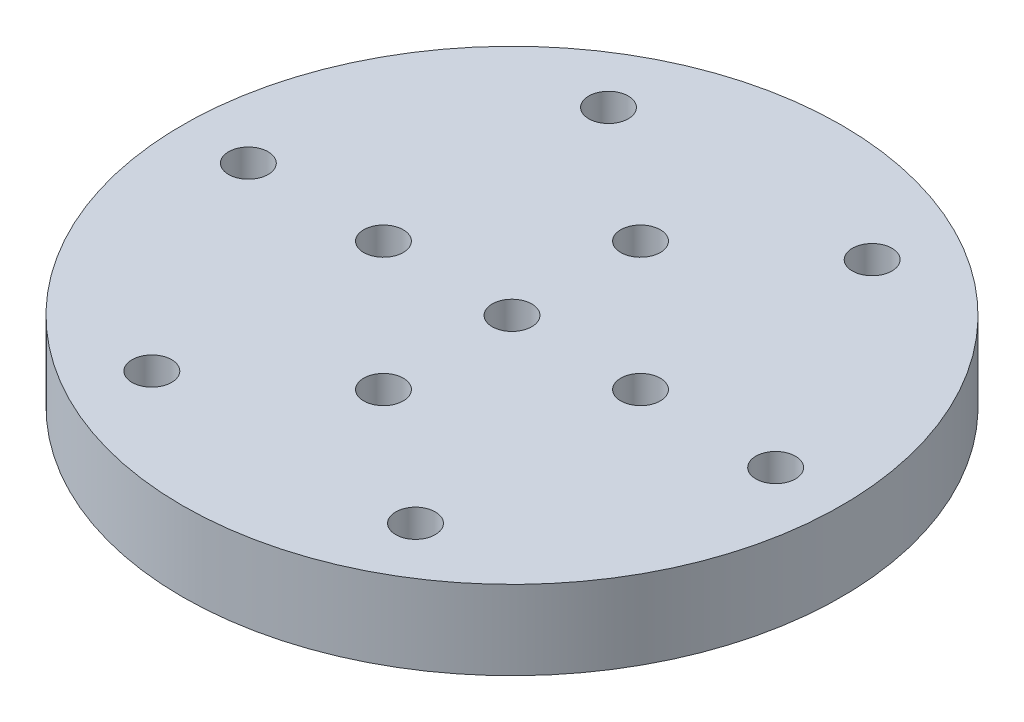
from build123d import *

# Parameters (mm, degrees)
SKETCH_1_R          = 25
EXTRUDE_1_DEPTH     = 6
SKETCH_2_R          = 1.5
CUT_EXTRUDE_1_DEPTH = 10


with BuildPart() as part:
    # 草图1 → 凸台-拉伸1 (new body)
    with BuildSketch(Plane(origin=(0, 0, 0), x_dir=(1, 0, 0), z_dir=(0, 1, 0))):
        with Locations(Location((0, 0, 0), (0, 0, 270))):
            Circle(SKETCH_1_R)
    extrude(amount=EXTRUDE_1_DEPTH)

    # 草图2 → 切除-拉伸1 (cut)
    with BuildSketch(Plane(origin=(0, 6, 0), x_dir=(1, 0, 0), z_dir=(0, 1, 0))):
        with Locations(Location((9.75, 0, 0), (0, 0, 270))):
            Circle(SKETCH_2_R)
        with Locations(Location((0, -9.75, 0), (0, 0, 270))):
            Circle(SKETCH_2_R)
        with Locations(Location((-9.75, 0, 0), (0, 0, 270))):
            Circle(SKETCH_2_R)
        with Locations(Location((0, 9.75, 0), (0, 0, 270))):
            Circle(SKETCH_2_R)
        with Locations(Location((0, 0, 0), (0, 0, 270))):
            Circle(SKETCH_2_R)
        with Locations(Location((-20, 0, 0), (0, 0, 270))):
            Circle(SKETCH_2_R)
        with Locations(Location((-10, 17.320508076, 0), (0, 0, 270))):
            Circle(SKETCH_2_R)
        with Locations(Location((10, 17.320508076, 0), (0, 0, 270))):
            Circle(SKETCH_2_R)
        with Locations(Location((20, 0, 0), (0, 0, 270))):
            Circle(SKETCH_2_R)
        with Locations(Location((10, -17.320508076, 0), (0, 0, 270))):
            Circle(SKETCH_2_R)
        with Locations(Location((-10, -17.320508076, 0), (0, 0, 270))):
            Circle(SKETCH_2_R)
    extrude(amount=-CUT_EXTRUDE_1_DEPTH, mode=Mode.SUBTRACT)


solid = part.part
